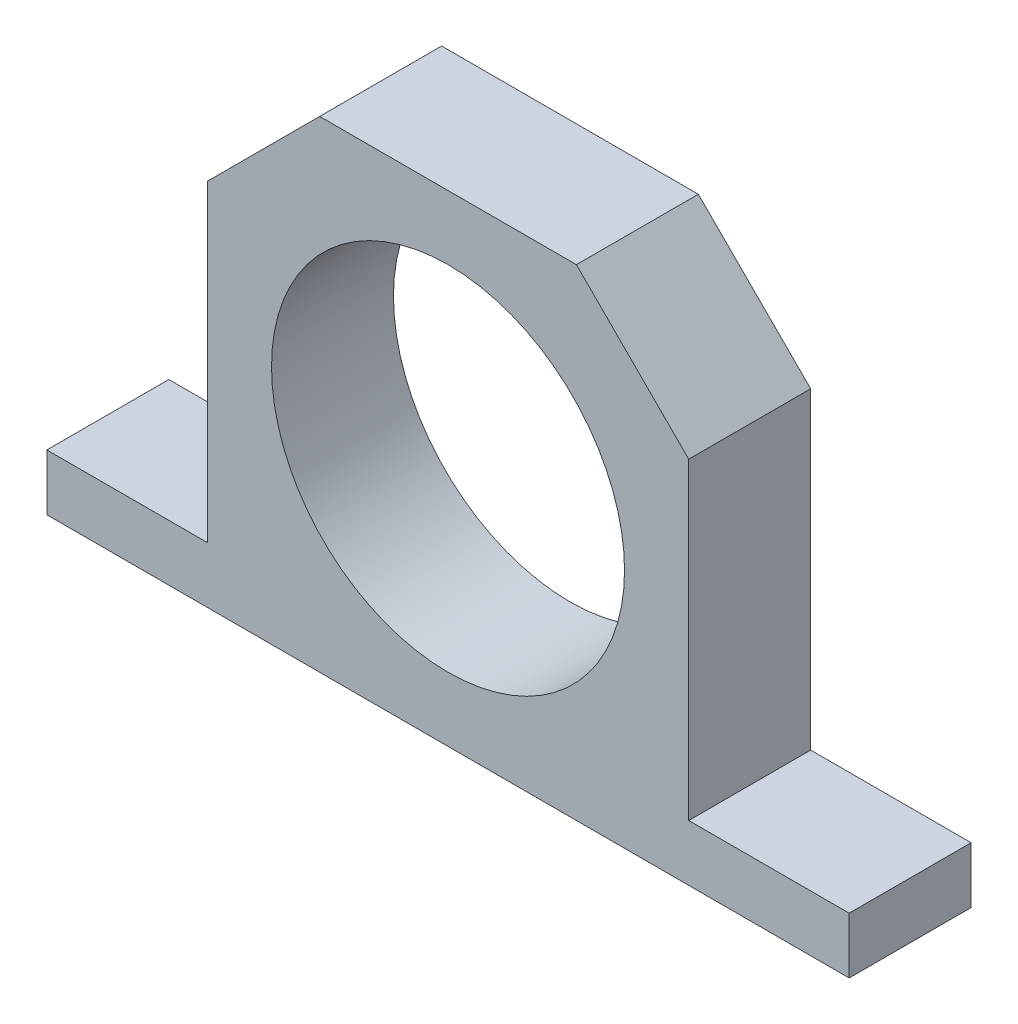
from build123d import *

# Parameters (mm, degrees)
SKETCH1_W           = 30
SKETCH1_H           = 7.6
BOSS_EXTRUDE1_DEPTH = 30
SKETCH2_R           = 11
CUT_EXTRUDE1_DEPTH  = 30
SKETCH3_W           = 50
SKETCH3_H           = 7.6
BOSS_EXTRUDE2_DEPTH = 3.5


with BuildPart() as part:
    # Sketch1 → Boss-Extrude1 (new body)
    with BuildSketch(Plane(origin=(0, 0, 0), x_dir=(1, 0, 0), z_dir=(0, 1, 0))):
        Rectangle(SKETCH1_W, SKETCH1_H)
    extrude(amount=BOSS_EXTRUDE1_DEPTH)

    # Sketch2 → Cut-Extrude1 (cut)
    with BuildSketch(Plane.XY.offset(3.8)):
        Polygon((-15, 30), (-15, 23), (-8, 30), align=None)
        Polygon((15, 30), (8, 30), (15, 23), align=None)
        with Locations((0, 15)):
            Circle(SKETCH2_R)
    extrude(amount=-CUT_EXTRUDE1_DEPTH, mode=Mode.SUBTRACT)

    # Sketch3 → Boss-Extrude2 (add)
    with BuildSketch(Plane.XZ):
        Rectangle(SKETCH3_W, SKETCH3_H)
    extrude(amount=-BOSS_EXTRUDE2_DEPTH)


solid = part.part
